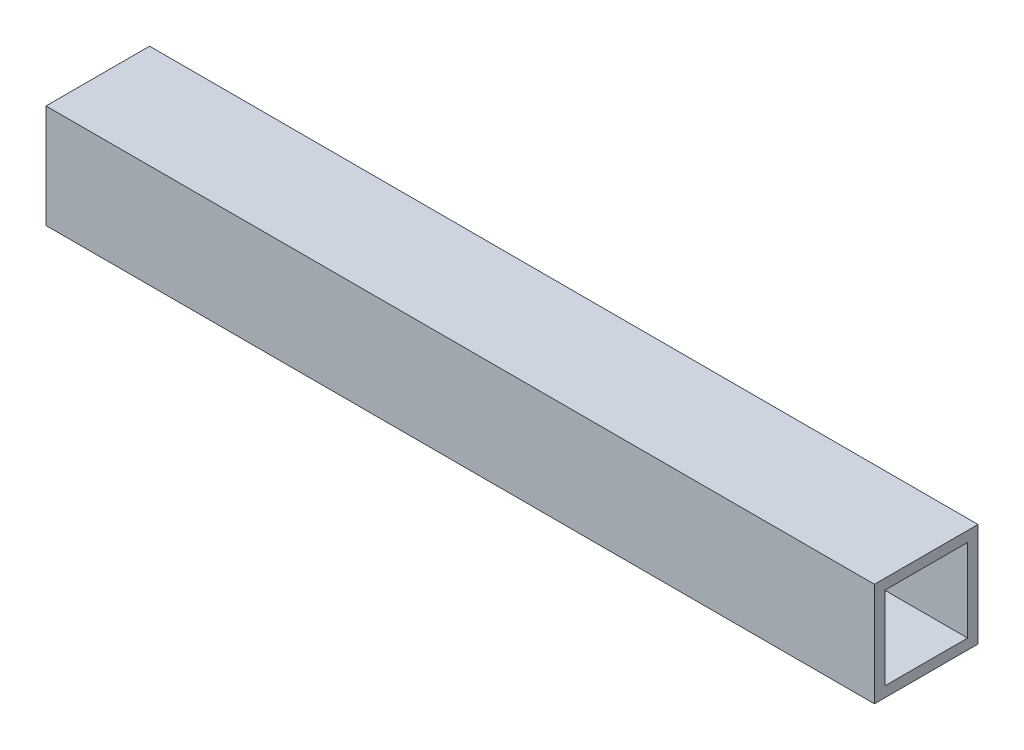
from build123d import *

# Parameters (mm, degrees)
SKETCH1_W           = 25.4
SKETCH1_H           = 25.4
SKETCH1_W_2         = 20.32
SKETCH1_H_2         = 20.32
BOSS_EXTRUDE1_DEPTH = 203.2


with BuildPart() as part:
    # Sketch1 → Boss-Extrude1 (new body)
    with BuildSketch(Plane(origin=(0, 0, 0), x_dir=(0, 0, -1), z_dir=(1, 0, 0))):
        Rectangle(SKETCH1_W, SKETCH1_H)
        Rectangle(SKETCH1_W_2, SKETCH1_H_2, mode=Mode.SUBTRACT)
    extrude(amount=BOSS_EXTRUDE1_DEPTH)


solid = part.part
